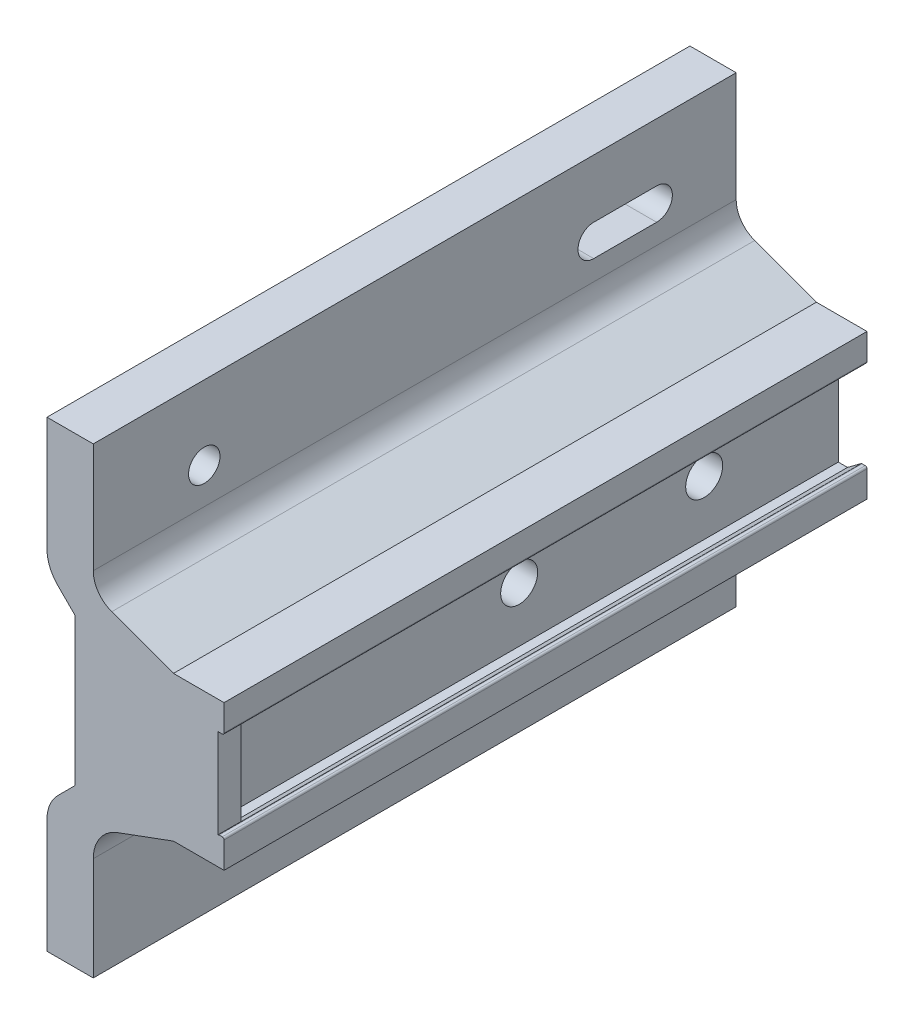
from build123d import *

# Parameters (mm, degrees)
BOSS_EXTRUDE2_DEPTH     = 69.5
BOSS_EXTRUDE3_DEPTH     = 69.5
CUT_EXTRUDE1_DEPTH      = 77.399445549
CUT_EXTRUDE1_DEPTH_BACK = 77.399445549
SKETCH7_R               = 2
CUT_EXTRUDE2_DEPTH      = 78.109924218
CUT_EXTRUDE2_DEPTH_BACK = 78.109924218
SKETCH8_R               = 1.7
FILLET1_R               = 0.2
BOSS_EXTRUDE4_DEPTH     = 2.5


with BuildPart() as part:
    # Sketch4 → Boss-Extrude2 (new body)
    with BuildSketch(Plane.XY):
        Polygon((-10.152602112, 10.223468411), (-10.152602112, -5.476531589), (-4.682602112, -5.476531589), (-4.682602112, -2.436531589), (-5.282780111, -2.436531589), (-6.782780111, -3.556531589), (-7.782602112, -3.556531589), (-7.782602112, 8.303468411), (-6.782780111, 8.303468411), (-5.282780111, 7.183468411), (-4.682602112, 7.183468411), (-4.682602112, 10.223468411), align=None)
    extrude(amount=BOSS_EXTRUDE2_DEPTH)

    # Sketch6 → Boss-Extrude3 (add)
    with BuildSketch(Plane.XY.offset(69.5)):
        with BuildLine():
            Line((-18.82375255, 27.373468411), (-23.82375255, 27.373468411))
            Line((-23.82375255, 27.373468411), (-23.82375255, 15.03032266))
            ThreePointArc((-23.82375255, 15.03032266), (-23.51927068, 13.499588931), (-22.652179675, 12.201895535))
            Line((-22.652179675, 12.201895535), (-20.82375255, 10.373468411))
            Line((-20.82375255, 10.373468411), (-20.82375255, -5.626531589))
            Line((-20.82375255, -5.626531589), (-22.652179675, -7.454958714))
            ThreePointArc((-22.652179675, -7.454958714), (-23.51927068, -8.752652109), (-23.82375255, -10.283385839))
            Line((-23.82375255, -10.283385839), (-23.82375255, -22.626531589))
            Line((-23.82375255, -22.626531589), (-18.82375255, -22.626531589))
            Line((-18.82375255, -22.626531589), (-18.82375255, -11.458931103))
            ThreePointArc((-18.82375255, -11.458931103), (-18.088209901, -9.14736925), (-16.152093449, -7.685933561))
            Line((-16.152093449, -7.685933561), (-10.152602112, -5.476531589))
            Line((-10.152602112, -5.476531589), (-10.152602112, 10.223468411))
            Line((-10.152602112, 10.223468411), (-16.820008224, 12.668019889))
            ThreePointArc((-16.820008224, 12.668019889), (-18.272095564, 13.764096656), (-18.82375255, 15.497768046))
            Line((-18.82375255, 15.497768046), (-18.82375255, 27.373468411))
        make_face()
    extrude(amount=-BOSS_EXTRUDE3_DEPTH)

    # Sketch7 → Cut-Extrude1 (cut, two sides: drawn at the far end of the back side and taken through both)
    with BuildSketch(Plane(origin=(-7.782602112, 0, 0), x_dir=(0, 0, -1), z_dir=(1, 0, 0)).offset(-CUT_EXTRUDE1_DEPTH_BACK)):
        with Locations(Location((-34.5, 2.373468411, 0), (0, 0, 180))):
            Circle(SKETCH7_R)
        with Locations(Location((-14.5, 2.373468411, 0), (0, 0, 180))):
            Circle(SKETCH7_R)
    extrude(amount=CUT_EXTRUDE1_DEPTH + CUT_EXTRUDE1_DEPTH_BACK, mode=Mode.SUBTRACT)

    # Sketch8 → Cut-Extrude2 (cut, two sides: drawn at the far end of the back side and taken through both)
    with BuildSketch(Plane.ZY.offset(23.82375255).offset(-CUT_EXTRUDE2_DEPTH_BACK)):
        with Locations(Location((57.5, 19.373468411, 0), (0, 0, 270))):
            Circle(SKETCH8_R)
        with Locations(Location((57.5, -14.626531589, 0), (0, 0, 270))):
            Circle(SKETCH8_R)
        with BuildLine():
            Line((15.4, 21.073468411), (8.6, 21.073468411))
            ThreePointArc((8.6, 21.073468411), (6.9, 19.373468411), (8.6, 17.673468411))
            Line((8.6, 17.673468411), (15.4, 17.673468411))
            ThreePointArc((15.4, 17.673468411), (17.1, 19.373468411), (15.4, 21.073468411))
        make_face()
        with BuildLine():
            Line((8.6, -12.926531589), (15.4, -12.926531589))
            ThreePointArc((15.4, -12.926531589), (17.1, -14.626531589), (15.4, -16.326531589))
            Line((15.4, -16.326531589), (8.6, -16.326531589))
            ThreePointArc((8.6, -16.326531589), (6.9, -14.626531589), (8.6, -12.926531589))
        make_face()
    extrude(amount=CUT_EXTRUDE2_DEPTH + CUT_EXTRUDE2_DEPTH_BACK, mode=Mode.SUBTRACT)

    # Fillet1
    fillet1_edges = [part.edges().sort_by_distance(p)[0] for p in [
        (-4.682602112, 7.183468411, 34.75),
        (-5.282780111, 7.183468411, 34.75),
        (-5.282780111, -2.436531589, 34.75),
        (-4.682602112, -2.436531589, 34.75),
    ]]
    fillet(fillet1_edges, radius=FILLET1_R)

    # Sketch9 → Boss-Extrude4 (add)
    with BuildSketch(Plane.XY.offset(69.5)):
        Polygon((-7.782602112, 8.303468411), (-7.782602112, -3.556531589), (-6.782780111, -3.556531589), (-5.336008623, -2.476275545), (-5.336008623, 7.223212366), (-6.782780111, 8.303468411), align=None)
    extrude(amount=-BOSS_EXTRUDE4_DEPTH)


solid = part.part
